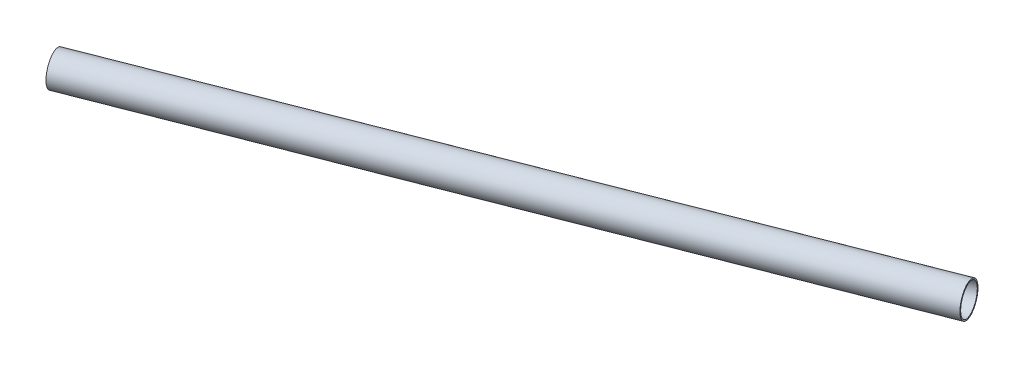
from build123d import *

# Parameters (mm, degrees)
SWEEP2_PROFILE_R     = 12.5
CUT_SWEEP2_PROFILE_R = 11.5


with BuildPart() as part:
    # Sweep2: sweep along a path in Sketch6
    with BuildLine(Plane(origin=(0, 0, 0), x_dir=(1, 0, 0), z_dir=(0, 1, 0))) as sweep2_path:
        Line((27.911860583, 24.714849031), (544.640102873, 226.686315947))
    # Sweep2 profile (on start of the path) → Sweep2 (sweep)
    with BuildSketch(Plane(origin=(27.911860583, 0, -24.714849031), x_dir=(0.3640452125264868, 0, 0.931381277048527), z_dir=(0.931381277048527, 0, -0.3640452125264868))):
        Circle(SWEEP2_PROFILE_R)
    sweep(path=sweep2_path.line)

    # Cut-Sweep2: sweep along a path in Sketch6<2>
    with BuildLine(Plane(origin=(0, 0, 0), x_dir=(1, 0, 0), z_dir=(0, 1, 0))) as cut_sweep2_path:
        Line((27.911860583, 24.714849031), (544.640102873, 226.686315947))
    # Cut-Sweep2 profile (on start of the path) → Cut-Sweep2 (sweep, cut)
    with BuildSketch(Plane(origin=(27.911860583, 0, -24.714849031), x_dir=(0.3640452125264868, 0, 0.931381277048527), z_dir=(0.931381277048527, 0, -0.3640452125264868))):
        Circle(CUT_SWEEP2_PROFILE_R)
    sweep(path=cut_sweep2_path.line, mode=Mode.SUBTRACT)


solid = part.part
